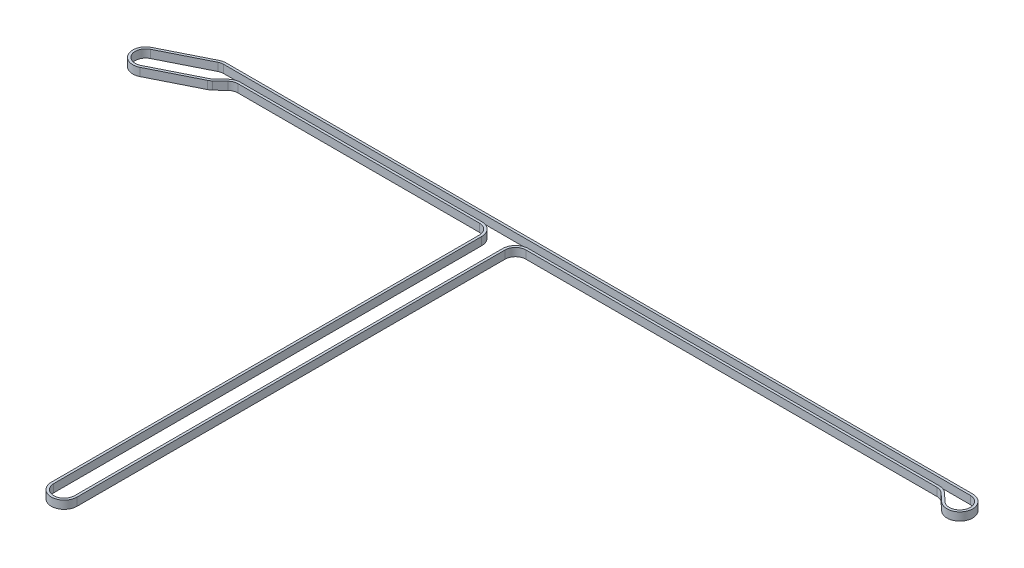
from build123d import *

# Parameters (mm, degrees)
BOSS_EXTRUDE1_DEPTH = 5


with BuildPart() as part:
    # Sketch2 → Boss-Extrude1 (new body)
    with BuildSketch(Plane(origin=(0, 0, 0), x_dir=(1, 0, 0), z_dir=(0, 1, 0))):
        with BuildLine():
            Line((3.577708764, -7.155417528), (31.577708764, 6.844582472))
            ThreePointArc((31.577708764, 6.844582472), (32.561861408, 7.42813417), (33.452703386, 8.1461102))
            Line((33.452703386, 8.1461102), (38.402075473, 12.756285462))
            ThreePointArc((38.402075473, 12.756285462), (40.451835644, 14.048382243), (42.832396974, 14.5))
            Line((42.832396974, 14.5), (192.832396974, 14.5))
            ThreePointArc((192.832396974, 14.5), (197.428591052, 12.596194078), (199.332396974, 8))
            Line((199.332396974, 8), (199.332396974, -258))
            ThreePointArc((199.332396974, -258), (207.332396974, -266), (215.332396974, -258))
            Line((215.332396974, -258), (215.332396974, 8))
            ThreePointArc((215.332396974, 8), (217.236202896, 12.596194078), (221.832396974, 14.5))
            Line((221.832396974, 14.5), (477.167603026, 14.5))
            ThreePointArc((477.167603026, 14.5), (479.548164356, 14.048382243), (481.597924527, 12.756285462))
            Line((481.597924527, 12.756285462), (486.547296614, 8.1461102))
            ThreePointArc((486.547296614, 8.1461102), (499.44416276, 11.070078362), (492, 22))
            Line((492, 22), (28, 22))
            ThreePointArc((28, 22), (26.161976636, 21.785991916), (24.422291236, 21.155417528))
            Line((24.422291236, 21.155417528), (-3.577708764, 7.155417528))
            ThreePointArc((-3.577708764, 7.155417528), (-7.155417528, -3.577708764), (3.577708764, -7.155417528))
        make_face()
        with BuildLine():
            Line((2.906888371, -5.813776741), (30.906888371, 8.186223259))
            ThreePointArc((30.906888371, 8.186223259), (31.706512394, 8.660359013), (32.430321501, 9.243714538))
            Line((32.430321501, 9.243714538), (37.379693588, 13.8538898))
            ThreePointArc((37.379693588, 13.8538898), (39.902475337, 15.44416276), (42.832396974, 16))
            Line((42.832396974, 16), (192.832396974, 16))
            ThreePointArc((192.832396974, 16), (198.489251224, 13.656854249), (200.832396974, 8))
            Line((200.832396974, 8), (200.832396974, -258))
            ThreePointArc((200.832396974, -258), (207.332396974, -264.5), (213.832396974, -258))
            Line((213.832396974, -258), (213.832396974, 8))
            ThreePointArc((213.832396974, 8), (216.175542725, 13.656854249), (221.832396974, 16))
            Line((221.832396974, 16), (477.167603026, 16))
            ThreePointArc((477.167603026, 16), (480.097524663, 15.44416276), (482.620306412, 13.8538898))
            Line((482.620306412, 13.8538898), (487.569678499, 9.243714538))
            ThreePointArc((487.569678499, 9.243714538), (498.048382243, 11.61943867), (492, 20.5))
            Line((492, 20.5), (28, 20.5))
            ThreePointArc((28, 20.5), (26.506606016, 20.326118432), (25.093111629, 19.813776741))
            Line((25.093111629, 19.813776741), (-2.906888371, 5.813776741))
            ThreePointArc((-2.906888371, 5.813776741), (-5.813776741, -2.906888371), (2.906888371, -5.813776741))
        make_face(mode=Mode.SUBTRACT)
    extrude(amount=BOSS_EXTRUDE1_DEPTH)


solid = part.part
